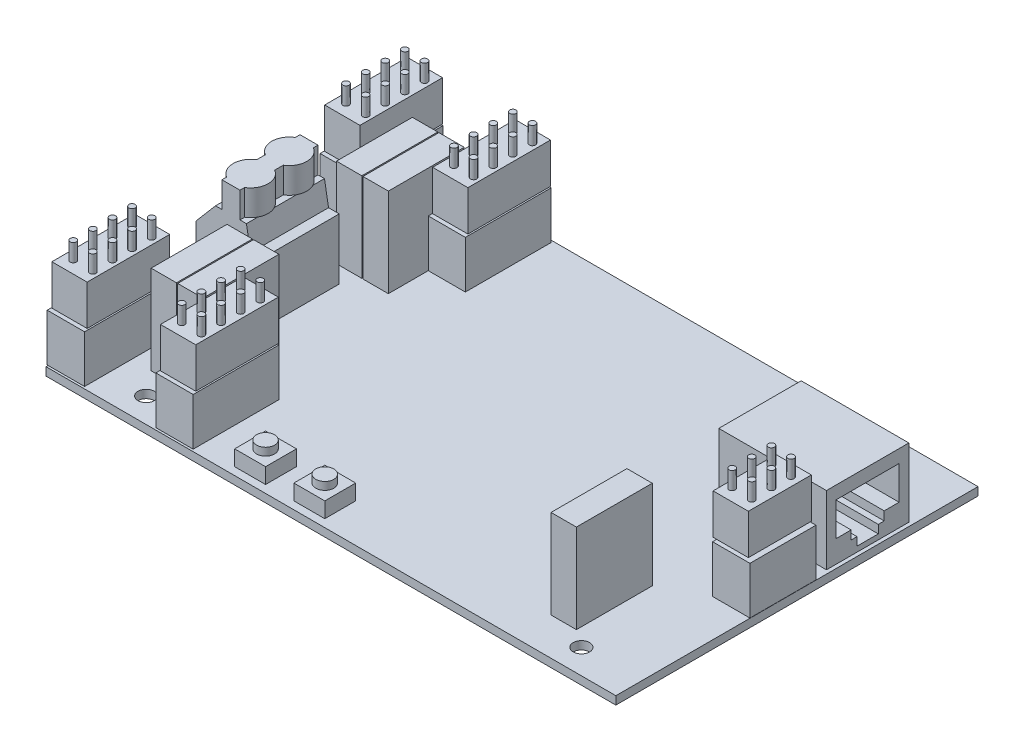
from build123d import *

# Parameters (mm, degrees)
SKETCH1_W              = 110.62
SKETCH1_H              = 70.3
SKETCH1_R              = 1.5875
BOSS_EXTRUDE1_DEPTH    = 1.5875
SKETCH2_R              = 0.5
CUT_EXTRUDE1_DEPTH     = 66.553327576
SKETCH3_W              = 4.92
SKETCH3_H              = 14.732
BOSS_EXTRUDE2_DEPTH    = 17.25
SKETCH4_W              = 12.7
SKETCH4_H              = 15.15
BOSS_EXTRUDE3_DEPTH    = 11.8
BOSS_EXTRUDE4_DEPTH    = 15.15
BOSS_EXTRUDE5_DEPTH    = 5
SKETCH7_W              = 20.9
SKETCH7_H              = 16
BOSS_EXTRUDE6_DEPTH    = 13.33
CUT_EXTRUDE2_DEPTH     = 10.5
SKETCH9_W              = 6
SKETCH9_H              = 6
BOSS_EXTRUDE7_DEPTH    = 3
SKETCH10_R             = 1.75
BOSS_EXTRUDE8_DEPTH    = 1.5
SKETCH11_W             = 7.25
SKETCH11_H             = 16.63
SKETCH11_H_2           = 12.82
BOSS_EXTRUDE9_DEPTH    = 9.2
BOSS_EXTRUDE10_START   = 0.5
SKETCH12_W             = 6.85
SKETCH12_H             = 16.03
BOSS_EXTRUDE10_DEPTH   = 7.8
BOSS_EXTRUDE10_2_DEPTH = 7.8
BOSS_EXTRUDE10_3_DEPTH = 7.8
BOSS_EXTRUDE10_4_DEPTH = 7.8
SKETCH12_H_2           = 12.22
BOSS_EXTRUDE10_5_DEPTH = 7.8
SKETCH13_R             = 0.6
BOSS_EXTRUDE11_DEPTH   = 3.4


with BuildPart() as part:
    # Sketch1 → Boss-Extrude1 (new body)
    with BuildSketch(Plane(origin=(0, 0, 0), x_dir=(1, 0, 0), z_dir=(0, 1, 0))):
        Rectangle(SKETCH1_W, SKETCH1_H)
        with Locations(Location((-40.6725, -30.35, 0), (0, 0, 270))):
            Circle(SKETCH1_R, mode=Mode.SUBTRACT)
        with Locations(Location((-40.6725, 30.35, 0), (0, 0, 270))):
            Circle(SKETCH1_R, mode=Mode.SUBTRACT)
        with Locations(Location((43.8275, 30.35, 0), (0, 0, 270))):
            Circle(SKETCH1_R, mode=Mode.SUBTRACT)
        with Locations(Location((43.8275, -30.35, 0), (0, 0, 270))):
            Circle(SKETCH1_R, mode=Mode.SUBTRACT)
    extrude(amount=-BOSS_EXTRUDE1_DEPTH)

    # Sketch2 → Cut-Extrude1 (cut, through all)
    with BuildSketch(Plane(origin=(0, 0, 0), x_dir=(1, 0, 0), z_dir=(0, 1, 0))):
        with Locations(Location((51.0175, 1.137, 0), (0, 0, 270))):
            Circle(SKETCH2_R)
        with Locations(Location((51.0175, -2.673, 0), (0, 0, 270))):
            Circle(SKETCH2_R)
        with Locations(Location((51.0175, -6.483, 0), (0, 0, 270))):
            Circle(SKETCH2_R)
        with Locations(Location((-30.1535, -20.707, 0), (0, 0, 270))):
            Circle(SKETCH2_R)
        with Locations(Location((-30.1535, -24.517, 0), (0, 0, 270))):
            Circle(SKETCH2_R)
        with Locations(Location((-30.1535, -28.327, 0), (0, 0, 270))):
            Circle(SKETCH2_R)
        with Locations(Location((-30.1535, -32.137, 0), (0, 0, 270))):
            Circle(SKETCH2_R)
        with Locations(Location((-30.1535, 32.125, 0), (0, 0, 270))):
            Circle(SKETCH2_R)
        with Locations(Location((-30.1535, 20.695, 0), (0, 0, 270))):
            Circle(SKETCH2_R)
        with Locations(Location((-30.1535, 24.505, 0), (0, 0, 270))):
            Circle(SKETCH2_R)
        with Locations(Location((-30.1535, 28.315, 0), (0, 0, 270))):
            Circle(SKETCH2_R)
        with Locations(Location((-51.1085, 28.315, 0), (0, 0, 270))):
            Circle(SKETCH2_R)
        with Locations(Location((-51.1085, 24.505, 0), (0, 0, 270))):
            Circle(SKETCH2_R)
        with Locations(Location((-51.2355, -28.327, 0), (0, 0, 270))):
            Circle(SKETCH2_R)
        with Locations(Location((-51.2355, -20.707, 0), (0, 0, 270))):
            Circle(SKETCH2_R)
        with Locations(Location((-51.2355, -24.517, 0), (0, 0, 270))):
            Circle(SKETCH2_R)
        with Locations(Location((-51.1085, 32.125, 0), (0, 0, 270))):
            Circle(SKETCH2_R)
        with Locations(Location((-51.2355, -32.137, 0), (0, 0, 270))):
            Circle(SKETCH2_R)
        with Locations(Location((-51.1085, 20.695, 0), (0, 0, 270))):
            Circle(SKETCH2_R)
    extrude(amount=-CUT_EXTRUDE1_DEPTH, mode=Mode.SUBTRACT)

    # Sketch3 → Boss-Extrude2 (add)
    with BuildSketch(Plane(origin=(0, 0, 0), x_dir=(1, 0, 0), z_dir=(0, 1, 0))):
        with Locations((-41.96, -18.264)):
            Rectangle(SKETCH3_W, SKETCH3_H)
        with Locations((-36.81, -18.264)):
            Rectangle(SKETCH3_W, SKETCH3_H)
        with Locations((-36.81, 17.714)):
            Rectangle(SKETCH3_W, SKETCH3_H)
        with Locations((-41.96, 17.714)):
            Rectangle(SKETCH3_W, SKETCH3_H)
        with Locations((37.92, -20.514)):
            Rectangle(SKETCH3_W, SKETCH3_H)
    extrude(amount=BOSS_EXTRUDE2_DEPTH)

    # Sketch4 → Boss-Extrude3 (add)
    with BuildSketch(Plane(origin=(0, 0, 0), x_dir=(1, 0, 0), z_dir=(0, 1, 0))):
        with Locations((-47.09, -0.375)):
            Rectangle(SKETCH4_W, SKETCH4_H)
    extrude(amount=BOSS_EXTRUDE3_DEPTH)

    # Sketch5 → Boss-Extrude4 (add)
    with BuildSketch(Plane.XY.offset(7.95)):
        Polygon((-53.44, 11.8), (-42.81, 11.8), (-43.603471413, 16.3), (-49.603471413, 16.3), align=None)
    extrude(amount=-BOSS_EXTRUDE4_DEPTH)

    # Sketch6 → Boss-Extrude5 (add)
    with BuildSketch(Plane(origin=(0, 16.3, 0), x_dir=(1, 0, 0), z_dir=(0, 1, 0))):
        with BuildLine():
            Line((-48.353471413, 7.2), (-44.853471413, 7.2))
            Line((-44.853471413, 7.2), (-44.853471413, 6.290047169))
            ThreePointArc((-44.853471413, 6.290047169), (-43.203471413, 3.375), (-44.853471413, 0.459952831))
            Line((-44.853471413, 0.459952831), (-44.853471413, -1.209952831))
            ThreePointArc((-44.853471413, -1.209952831), (-43.203471413, -4.125), (-44.853471413, -7.040047169))
            Line((-44.853471413, -7.040047169), (-44.853471413, -7.95))
            Line((-44.853471413, -7.95), (-48.353471413, -7.95))
            Line((-48.353471413, -7.95), (-48.353471413, -7.040047169))
            ThreePointArc((-48.353471413, -7.040047169), (-50.003471413, -4.125), (-48.353471413, -1.209952831))
            Line((-48.353471413, -1.209952831), (-48.353471413, 0.459952831))
            ThreePointArc((-48.353471413, 0.459952831), (-50.003471413, 3.375), (-48.353471413, 6.290047169))
            Line((-48.353471413, 6.290047169), (-48.353471413, 7.2))
        make_face()
    extrude(amount=BOSS_EXTRUDE5_DEPTH)

    # Sketch7 → Boss-Extrude6 (add)
    with BuildSketch(Plane(origin=(0, 0, 0), x_dir=(1, 0, 0), z_dir=(0, 1, 0))):
        with Locations((44.14, 14.45)):
            Rectangle(SKETCH7_W, SKETCH7_H)
    extrude(amount=BOSS_EXTRUDE6_DEPTH)

    # Sketch8 → Cut-Extrude2 (cut)
    with BuildSketch(Plane(origin=(54.59, 0, 0), x_dir=(0, 0, -1), z_dir=(1, 0, 0))):
        Polygon((16.51, 2.6125), (17.66, 2.6125), (17.66, 4.3125), (20.55, 4.3125), (20.55, 10.83), (8.35, 10.83), (8.35, 4.3125), (11.24, 4.3125), (11.24, 2.6125), (12.39, 2.6125), (12.39, 1.0125), (16.51, 1.0125), align=None)
    extrude(amount=-CUT_EXTRUDE2_DEPTH, mode=Mode.SUBTRACT)

    # Sketch9 → Boss-Extrude7 (add)
    with BuildSketch(Plane(origin=(0, 0, 0), x_dir=(1, 0, 0), z_dir=(0, 1, 0))):
        with Locations((-17.19, -30.65)):
            Rectangle(SKETCH9_W, SKETCH9_H)
        with Locations((-5.69, -30.65)):
            Rectangle(SKETCH9_W, SKETCH9_H)
    extrude(amount=BOSS_EXTRUDE7_DEPTH)

    # Sketch10 → Boss-Extrude8 (add)
    with BuildSketch(Plane(origin=(0, 3, 0), x_dir=(1, 0, 0), z_dir=(0, 1, 0))):
        with Locations(Location((-17.19, -30.65, 0), (0, 0, 270))):
            Circle(SKETCH10_R)
        with Locations(Location((-5.69, -30.65, 0), (0, 0, 270))):
            Circle(SKETCH10_R)
    extrude(amount=BOSS_EXTRUDE8_DEPTH)

    # Sketch11 → Boss-Extrude9 (add)
    with BuildSketch(Plane(origin=(0, 0, 0), x_dir=(1, 0, 0), z_dir=(0, 1, 0))):
        with Locations((-30.7785, 26.41)):
            Rectangle(SKETCH11_W, SKETCH11_H)
        with Locations((-51.7335, 26.41)):
            Rectangle(SKETCH11_W, SKETCH11_H)
        with Locations((-51.8605, -26.422)):
            Rectangle(SKETCH11_W, SKETCH11_H)
        with Locations((-30.7785, -26.422)):
            Rectangle(SKETCH11_W, SKETCH11_H)
        with Locations((51.6425, -2.673)):
            Rectangle(SKETCH11_W, SKETCH11_H_2)
    extrude(amount=BOSS_EXTRUDE9_DEPTH)


with BuildPart() as body_2:
    # Sketch12 → Boss-Extrude10 (new body)
    with BuildSketch(Plane(origin=(0, 9.2, 0), x_dir=(1, 0, 0), z_dir=(0, 1, 0)).offset(BOSS_EXTRUDE10_START)):
        with Locations((-51.4605, -26.422)):
            Rectangle(SKETCH12_W, SKETCH12_H)
    extrude(amount=BOSS_EXTRUDE10_DEPTH)



with BuildPart() as body_3:
    # Sketch12 → Boss-Extrude10 2 (new body)
    with BuildSketch(Plane(origin=(0, 9.2, 0), x_dir=(1, 0, 0), z_dir=(0, 1, 0)).offset(BOSS_EXTRUDE10_START)):
        with Locations((-51.3335, 26.41)):
            Rectangle(SKETCH12_W, SKETCH12_H)
    extrude(amount=BOSS_EXTRUDE10_2_DEPTH)


with BuildPart() as body_4:
    # Sketch12 → Boss-Extrude10 3 (new body)
    with BuildSketch(Plane(origin=(0, 9.2, 0), x_dir=(1, 0, 0), z_dir=(0, 1, 0)).offset(BOSS_EXTRUDE10_START)):
        with Locations((-30.3785, -26.422)):
            Rectangle(SKETCH12_W, SKETCH12_H)
    extrude(amount=BOSS_EXTRUDE10_3_DEPTH)


with BuildPart() as body_5:
    # Sketch12 → Boss-Extrude10 4 (new body)
    with BuildSketch(Plane(origin=(0, 9.2, 0), x_dir=(1, 0, 0), z_dir=(0, 1, 0)).offset(BOSS_EXTRUDE10_START)):
        with Locations((-30.3785, 26.41)):
            Rectangle(SKETCH12_W, SKETCH12_H)
    extrude(amount=BOSS_EXTRUDE10_4_DEPTH)


with BuildPart() as body_6:
    # Sketch12 → Boss-Extrude10 5 (new body)
    with BuildSketch(Plane(origin=(0, 9.2, 0), x_dir=(1, 0, 0), z_dir=(0, 1, 0)).offset(BOSS_EXTRUDE10_START)):
        with Locations((51.2425, -2.673)):
            Rectangle(SKETCH12_W, SKETCH12_H_2)
    extrude(amount=BOSS_EXTRUDE10_5_DEPTH)


with BuildPart() as body_2_1:
    add(body_2.part)

    add(body_3.part)  # Boss-Extrude11 merges body 3

    add(body_4.part)  # Boss-Extrude11 merges body 4

    add(body_5.part)  # Boss-Extrude11 merges body 5
    # Sketch13 → Boss-Extrude11 (add)
    with BuildSketch(Plane(origin=(0, 17.5, 0), x_dir=(1, 0, 0), z_dir=(0, 1, 0))):
        with Locations(Location((-49.2355, -20.707, 0), (0, 0, 90))):
            Circle(SKETCH13_R)
        with Locations(Location((-28.1535, -20.707, 0), (0, 0, 90))):
            Circle(SKETCH13_R)
        with Locations(Location((-28.1535, 32.125, 0), (0, 0, 90))):
            Circle(SKETCH13_R)
        with Locations(Location((-49.1085, 32.125, 0), (0, 0, 90))):
            Circle(SKETCH13_R)
        with Locations(Location((49.2175, -6.483, 0), (0, 0, 270))):
            Circle(SKETCH13_R)
        with Locations(Location((-52.9185, 32.125, 0), (0, 0, 90))):
            Circle(SKETCH13_R)
        with Locations(Location((-31.9635, 32.125, 0), (0, 0, 90))):
            Circle(SKETCH13_R)
        with Locations(Location((-53.0455, -20.707, 0), (0, 0, 90))):
            Circle(SKETCH13_R)
        with Locations(Location((-31.9635, -20.707, 0), (0, 0, 90))):
            Circle(SKETCH13_R)
        with Locations(Location((-52.9185, 28.315, 0), (0, 0, 90))):
            Circle(SKETCH13_R)
        with Locations(Location((-31.9635, 28.315, 0), (0, 0, 90))):
            Circle(SKETCH13_R)
        with Locations(Location((-53.0455, -24.517, 0), (0, 0, 90))):
            Circle(SKETCH13_R)
        with Locations(Location((-31.9635, -24.517, 0), (0, 0, 90))):
            Circle(SKETCH13_R)
        with Locations(Location((-52.9185, 24.505, 0), (0, 0, 90))):
            Circle(SKETCH13_R)
        with Locations(Location((-31.9635, 24.505, 0), (0, 0, 90))):
            Circle(SKETCH13_R)
        with Locations(Location((-53.0455, -28.327, 0), (0, 0, 90))):
            Circle(SKETCH13_R)
        with Locations(Location((-31.9635, -28.327, 0), (0, 0, 90))):
            Circle(SKETCH13_R)
        with Locations(Location((-52.9185, 20.695, 0), (0, 0, 90))):
            Circle(SKETCH13_R)
        with Locations(Location((-31.9635, 20.695, 0), (0, 0, 90))):
            Circle(SKETCH13_R)
        with Locations(Location((-53.0455, -32.137, 0), (0, 0, 90))):
            Circle(SKETCH13_R)
        with Locations(Location((-31.9635, -32.137, 0), (0, 0, 90))):
            Circle(SKETCH13_R)
        with Locations(Location((-49.1085, 28.315, 0), (0, 0, 90))):
            Circle(SKETCH13_R)
        with Locations(Location((-28.1535, 28.315, 0), (0, 0, 90))):
            Circle(SKETCH13_R)
        with Locations(Location((-49.2355, -24.517, 0), (0, 0, 90))):
            Circle(SKETCH13_R)
        with Locations(Location((-28.1535, -24.517, 0), (0, 0, 90))):
            Circle(SKETCH13_R)
        with Locations(Location((-49.1085, 24.505, 0), (0, 0, 90))):
            Circle(SKETCH13_R)
        with Locations(Location((-28.1535, 24.505, 0), (0, 0, 90))):
            Circle(SKETCH13_R)
        with Locations(Location((-49.2355, -28.327, 0), (0, 0, 90))):
            Circle(SKETCH13_R)
        with Locations(Location((-28.1535, -28.327, 0), (0, 0, 90))):
            Circle(SKETCH13_R)
        with Locations(Location((-49.1085, 20.695, 0), (0, 0, 90))):
            Circle(SKETCH13_R)
        with Locations(Location((-28.1535, 20.695, 0), (0, 0, 90))):
            Circle(SKETCH13_R)
        with Locations(Location((-49.2355, -32.137, 0), (0, 0, 90))):
            Circle(SKETCH13_R)
        with Locations(Location((-28.1535, -32.137, 0), (0, 0, 90))):
            Circle(SKETCH13_R)
        with Locations(Location((53.0275, -6.483, 0), (0, 0, 270))):
            Circle(SKETCH13_R)
        with Locations(Location((53.0275, -2.673, 0), (0, 0, 270))):
            Circle(SKETCH13_R)
        with Locations(Location((53.0275, 1.137, 0), (0, 0, 270))):
            Circle(SKETCH13_R)
        with Locations(Location((49.2175, -2.673, 0), (0, 0, 270))):
            Circle(SKETCH13_R)
        with Locations(Location((49.2175, 1.137, 0), (0, 0, 270))):
            Circle(SKETCH13_R)
    extrude(amount=BOSS_EXTRUDE11_DEPTH)


solid = Compound([part.part, body_6.part, body_2_1.part])
